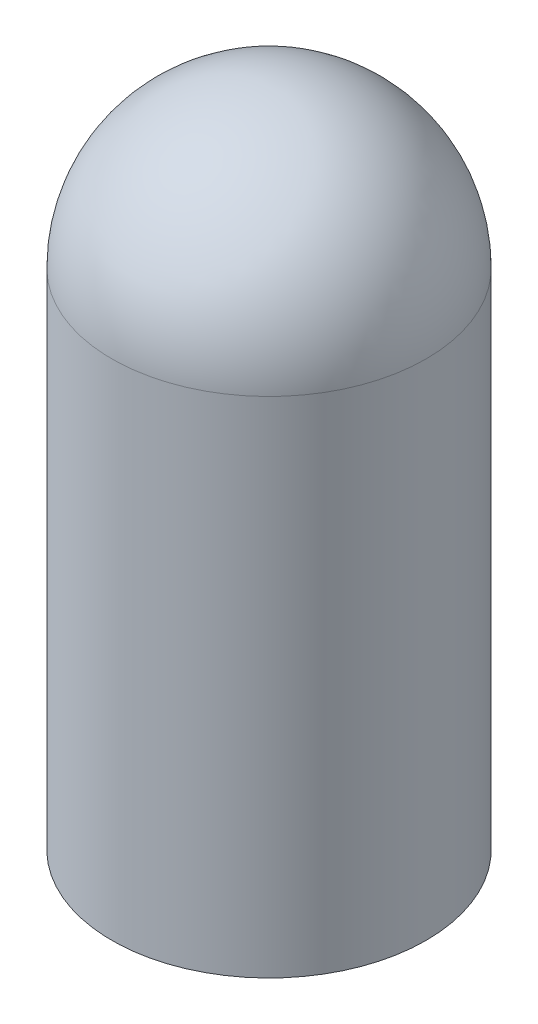
from build123d import *

# Parameters (mm, degrees)
SHELL1_T = -0.5


with BuildPart() as part:
    # Sketch1 → Revolve1 (revolve)
    with BuildSketch(Plane.XY, mode=Mode.PRIVATE) as revolve1_sk:
        with BuildLine():
            Line((9.75, 0), (9.75, 31.25))
            ThreePointArc((9.75, 31.25), (6.894291117, 38.144291117), (0, 41))
            Line((0, 41), (0, 0))
            Line((0, 0), (9.75, 0))
        make_face()
    revolve(revolve1_sk.sketch.rotate(Axis((0, 41, 0), (0, -1, 0)), 180), axis=Axis((0, 41, 0), (0, -1, 0)))

    # Shell1
    shell1_openings = [part.faces().sort_by_distance(p)[0] for p in [
        (0, 0, 0),
    ]]
    offset(amount=SHELL1_T, openings=shell1_openings, kind=Kind.INTERSECTION)


solid = part.part
